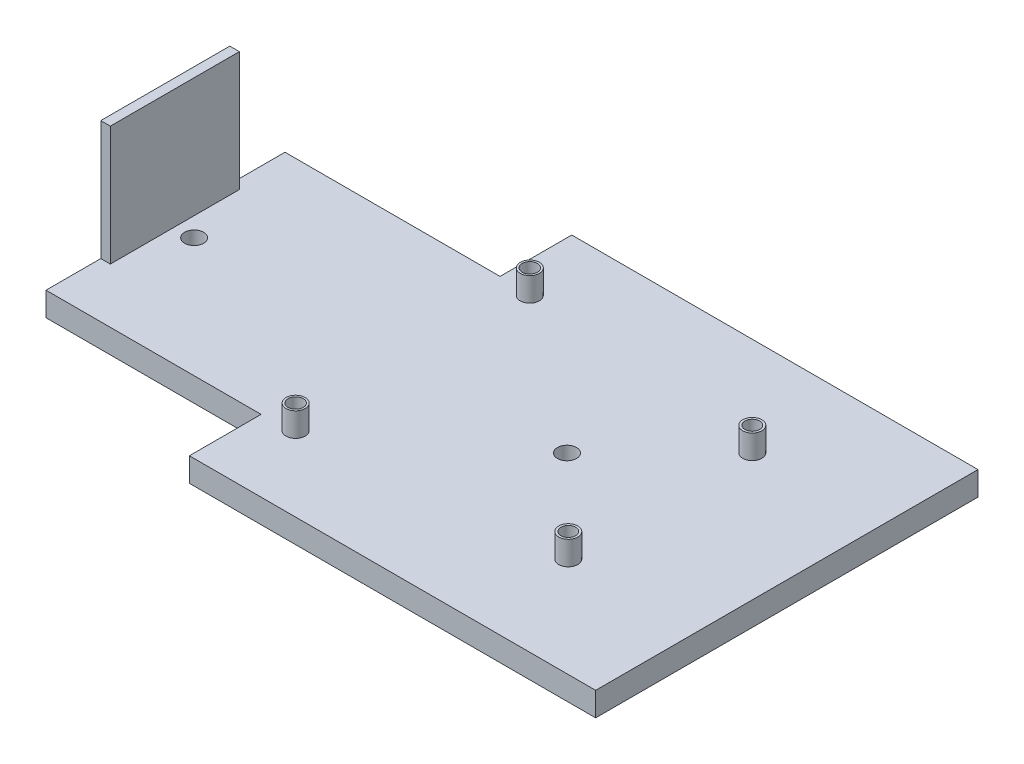
from build123d import *

# Parameters (mm, degrees)
BOSS_EXTRUDE2_DEPTH = 5
SKETCH3_R           = 2
CUT_EXTRUDE1_DEPTH  = 18
SKETCH6_R           = 2
SKETCH6_R_2         = 1.596148068
SKETCH6_R_3         = 1.596152716
SKETCH6_R_4         = 1.546268175
SKETCH6_R_5         = 1.546272671
BOSS_EXTRUDE3_DEPTH = 5
SKETCH9_W           = 2
SKETCH9_H           = 27
BOSS_EXTRUDE5_DEPTH = 25


with BuildPart() as part:
    # Sketch2 → Boss-Extrude2 (new body)
    with BuildSketch(Plane(origin=(0, 0, 0), x_dir=(1, 0, 0), z_dir=(0, 1, 0))):
        Polygon((-113.562992126, 63.956692913), (-113.562992126, 78.956692913), (-28.562992126, 78.956692913), (-28.562992126, -1.043307087), (-113.562992126, -1.043307087), (-113.562992126, 13.956692913), (-158.562992126, 13.956692913), (-158.562992126, 63.956692913), align=None)
    extrude(amount=BOSS_EXTRUDE2_DEPTH)

    # Sketch3 → Cut-Extrude1 (cut)
    with BuildSketch(Plane(origin=(0, 5, 0), x_dir=(1, 0, 0), z_dir=(0, 1, 0))):
        with Locations(Location((-74.562992126, 38.956692913, 0), (0, 0, 270))):
            Circle(SKETCH3_R)
        with Locations(Location((-152.562992126, 38.956692913, 0), (0, 0, 270))):
            Circle(SKETCH3_R)
    extrude(amount=-CUT_EXTRUDE1_DEPTH, mode=Mode.SUBTRACT)

    # Sketch6 → Boss-Extrude3 (add)
    # profile 1 of 4: a face of its own
    with BuildSketch(Plane(origin=(0, 5, 0), x_dir=(1, 0, 0), z_dir=(0, 1, 0))):
        with Locations(Location((-107.006745746, 63.623929763, 0), (0, 0, 270))):
            Circle(SKETCH6_R)
        with Locations(Location((-107.006745746, 63.623929763, 0), (0, 0, 270))):
            Circle(SKETCH6_R_2, mode=Mode.SUBTRACT)
    # profile 2 of 4: a face of its own
    with BuildSketch(Plane(origin=(0, 5, 0), x_dir=(1, 0, 0), z_dir=(0, 1, 0))):
        with Locations(Location((-107.006746212, 14.623929182, 0), (0, 0, 270))):
            Circle(SKETCH6_R)
        with Locations(Location((-107.006746212, 14.623929182, 0), (0, 0, 270))):
            Circle(SKETCH6_R_3, mode=Mode.SUBTRACT)
    # profile 3 of 4: a face of its own
    with BuildSketch(Plane(origin=(0, 5, 0), x_dir=(1, 0, 0), z_dir=(0, 1, 0))):
        with Locations(Location((-55.206742331, 19.873926739, 0), (0, 0, 270))):
            Circle(SKETCH6_R)
        with Locations(Location((-55.206742331, 19.873926739, 0), (0, 0, 270))):
            Circle(SKETCH6_R_4, mode=Mode.SUBTRACT)
    # profile 4 of 4: a face of its own
    with BuildSketch(Plane(origin=(0, 5, 0), x_dir=(1, 0, 0), z_dir=(0, 1, 0))):
        with Locations(Location((-55.206746033, 58.373928486, 0), (0, 0, 270))):
            Circle(SKETCH6_R)
        with Locations(Location((-55.206746033, 58.373928486, 0), (0, 0, 270))):
            Circle(SKETCH6_R_5, mode=Mode.SUBTRACT)
    extrude(amount=BOSS_EXTRUDE3_DEPTH)

    # Sketch9 → Boss-Extrude5 (add)
    with BuildSketch(Plane(origin=(0, 5, 0), x_dir=(1, 0, 0), z_dir=(0, 1, 0))):
        with Locations((-157.562992126, 38.912665697)):
            Rectangle(SKETCH9_W, SKETCH9_H)
    extrude(amount=BOSS_EXTRUDE5_DEPTH)


solid = part.part
